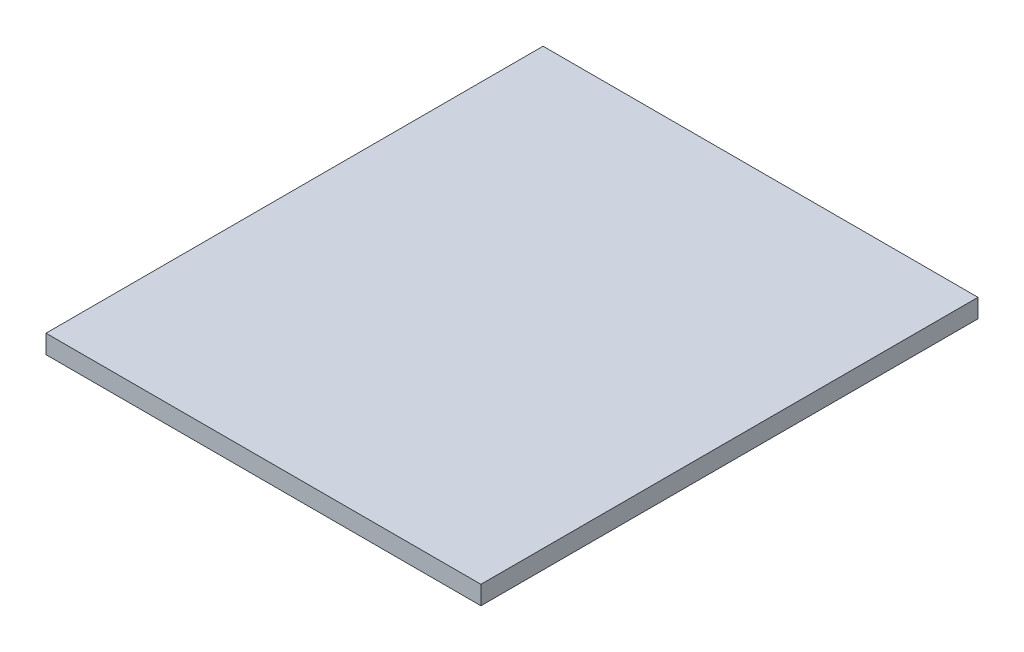
from build123d import *

# Parameters (mm, degrees)
ESQUISSE1_W        = 70
ESQUISSE1_H        = 80
BOSS_EXTRU_1_DEPTH = 3


with BuildPart() as part:
    # Esquisse1 → Boss.-Extru.1 (new body)
    with BuildSketch(Plane(origin=(0, 0, 0), x_dir=(1, 0, 0), z_dir=(0, 1, 0))):
        Rectangle(ESQUISSE1_W, ESQUISSE1_H)
    extrude(amount=BOSS_EXTRU_1_DEPTH)


solid = part.part
